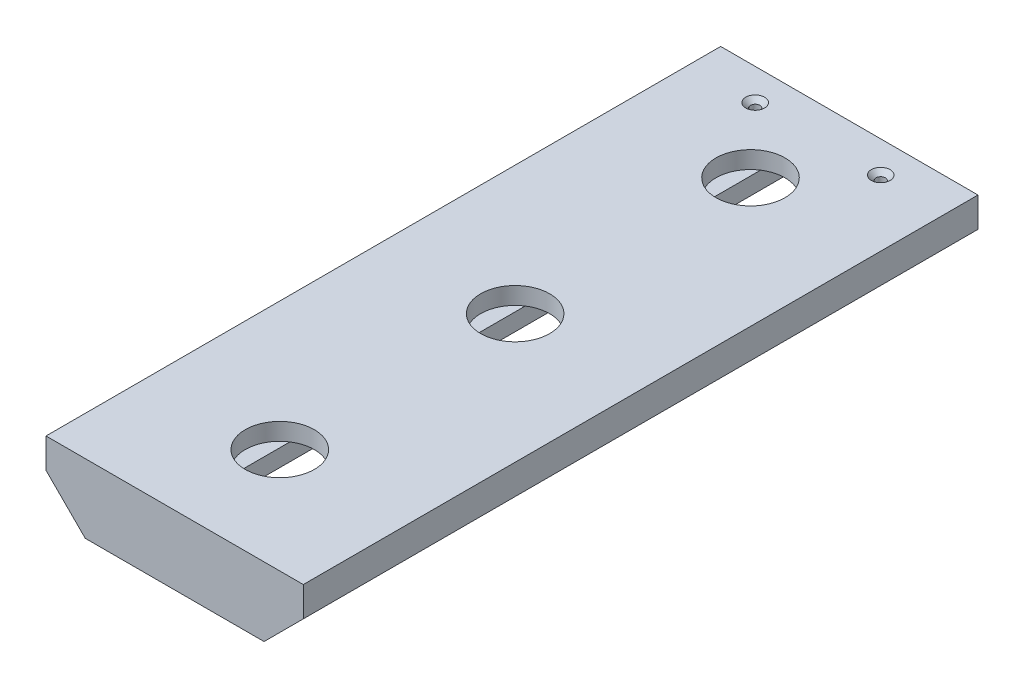
from build123d import *

# Parameters (mm, degrees)
BOSS_EXTRUDE2_DEPTH = 213
BOSS_EXTRUDE4_DEPTH = 2
SKETCH4_R           = 1.5
CUT_EXTRUDE1_DEPTH  = 10
CHAMFER2_SIZE       = 1.5
SKETCH5_R           = 11
CUT_EXTRUDE2_DEPTH  = 52


with BuildPart() as part:
    # Sketch1 → Boss-Extrude2 (new body)
    with BuildSketch(Plane.XY):
        Polygon((23.240231027, 8.911538462), (23.240231027, 14.411538462), (14.033124245, 14.411538462), (4.740231027, 23.70443168), (4.740231027, 25.411538462), (75.740231027, 25.411538462), (75.740231027, 23.70443168), (66.447337808, 14.411538462), (57.240231027, 14.411538462), (57.240231027, 8.911538462), (68.725512401, 8.911538462), (81.240231027, 21.426257087), (81.240231027, 30.911538462), (-0.759768973, 30.911538462), (-0.759768973, 21.426257087), (11.754949652, 8.911538462), align=None)
    extrude(amount=BOSS_EXTRUDE2_DEPTH)

    # Sketch3 → Boss-Extrude4 (add)
    with BuildSketch(Plane.XY.offset(213)):
        Polygon((-0.759768973, 30.911538462), (-0.759768973, 21.426257087), (11.754949652, 8.911538462), (23.240231027, 8.911538462), (57.240231027, 8.911538462), (68.725512401, 8.911538462), (81.240231027, 21.426257087), (81.240231027, 30.911538462), align=None)
    extrude(amount=BOSS_EXTRUDE4_DEPTH)

    # Sketch4 → Cut-Extrude1 (cut)
    with BuildSketch(Plane(origin=(0, 30.911538462, 0), x_dir=(1, 0, 0), z_dir=(0, 1, 0))):
        with Locations(Location((60.240231027, -10, 0), (0, 0, 180))):
            Circle(SKETCH4_R)
        with Locations(Location((20.240231027, -10, 0), (0, 0, 270))):
            Circle(SKETCH4_R)
    extrude(amount=-CUT_EXTRUDE1_DEPTH, mode=Mode.SUBTRACT)

    # Chamfer2
    chamfer2_edges = [part.edges().sort_by_distance(p)[0] for p in [
        (61.740231027, 30.911538462, 10),
        (20.240231027, 30.911538462, 8.5),
    ]]
    chamfer(chamfer2_edges, length=CHAMFER2_SIZE)

    # Sketch5 → Cut-Extrude2 (cut)
    with BuildSketch(Plane(origin=(0, 30.911538462, 0), x_dir=(1, 0, 0), z_dir=(0, 1, 0))):
        with Locations(Location((40.240231027, -31.5, 0), (0, 0, 180))):
            Circle(SKETCH5_R)
        with Locations(Location((40.240231027, -106.5, 0), (0, 0, 180))):
            Circle(SKETCH5_R)
        with Locations(Location((40.240231027, -181.5, 0), (0, 0, 180))):
            Circle(SKETCH5_R)
    extrude(amount=-CUT_EXTRUDE2_DEPTH, mode=Mode.SUBTRACT)


solid = part.part
